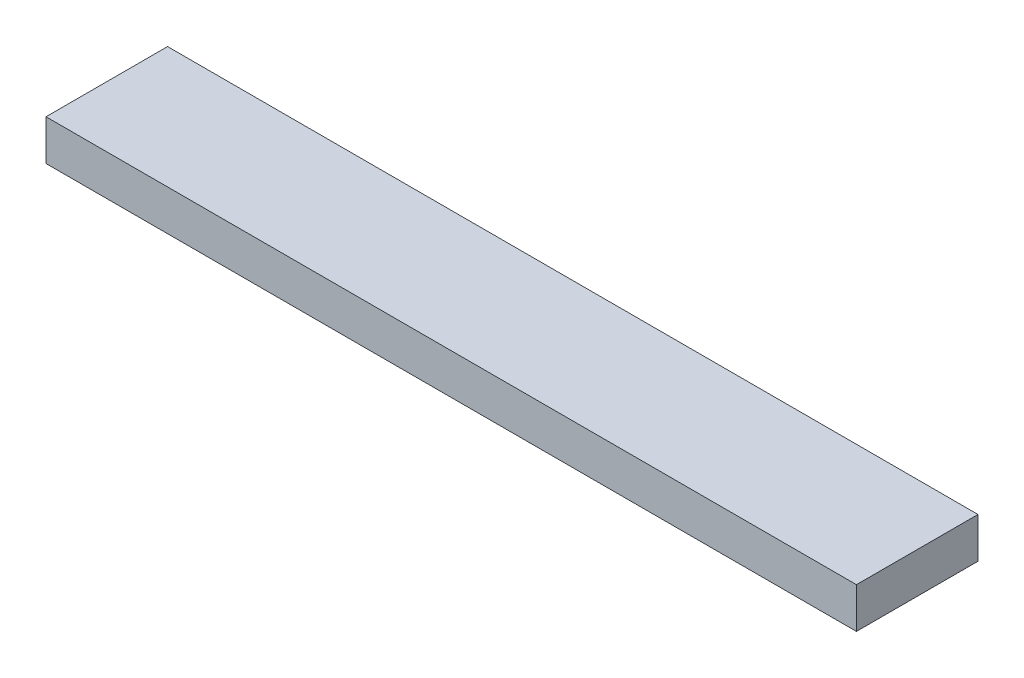
from build123d import *

# Parameters (mm, degrees)
CROQUIS2_W              = 1000
CROQUIS2_H              = 150
SALIENTE_EXTRUIR1_DEPTH = 50


with BuildPart() as part:
    # Croquis2 → Saliente-Extruir1 (new body)
    with BuildSketch(Plane(origin=(0, 0, 0), x_dir=(1, 0, 0), z_dir=(0, 1, 0))):
        Rectangle(CROQUIS2_W, CROQUIS2_H)
    extrude(amount=SALIENTE_EXTRUIR1_DEPTH)


solid = part.part
